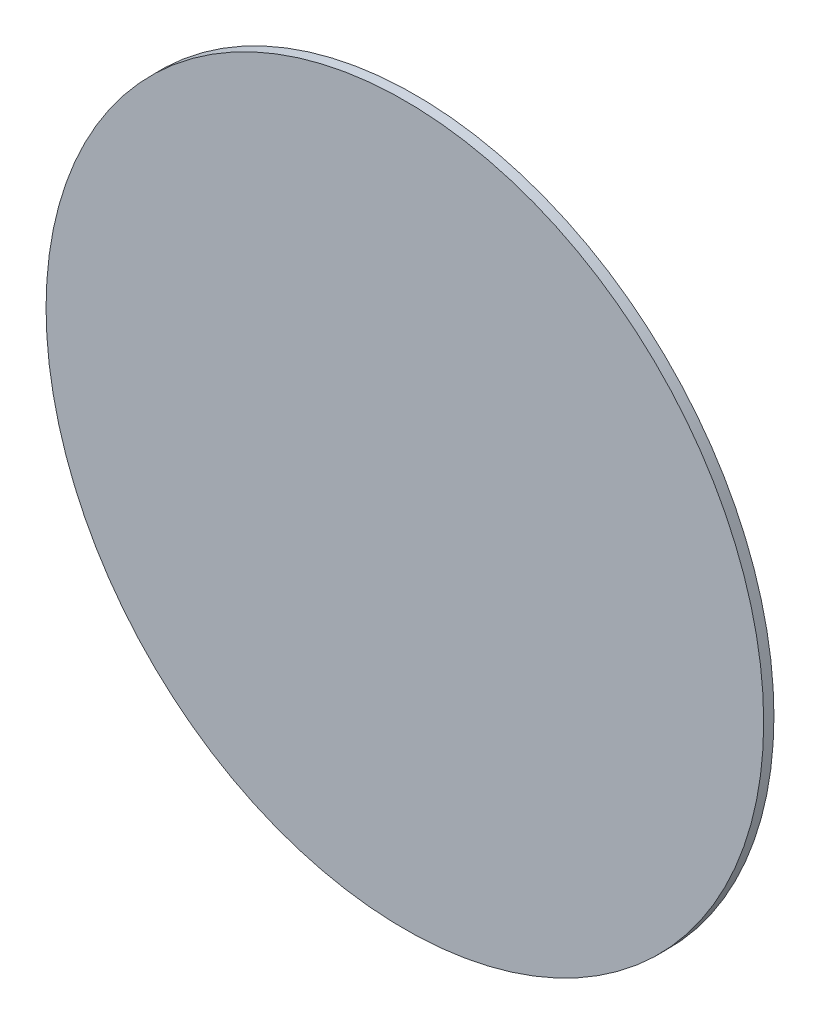
from build123d import *

# Parameters (mm, degrees)
SKETCH1_R           = 70
BOSS_EXTRUDE1_DEPTH = 2


with BuildPart() as part:
    # Sketch1 → Boss-Extrude1 (new body)
    with BuildSketch(Plane.XY):
        Circle(SKETCH1_R)
    extrude(amount=BOSS_EXTRUDE1_DEPTH)


solid = part.part
